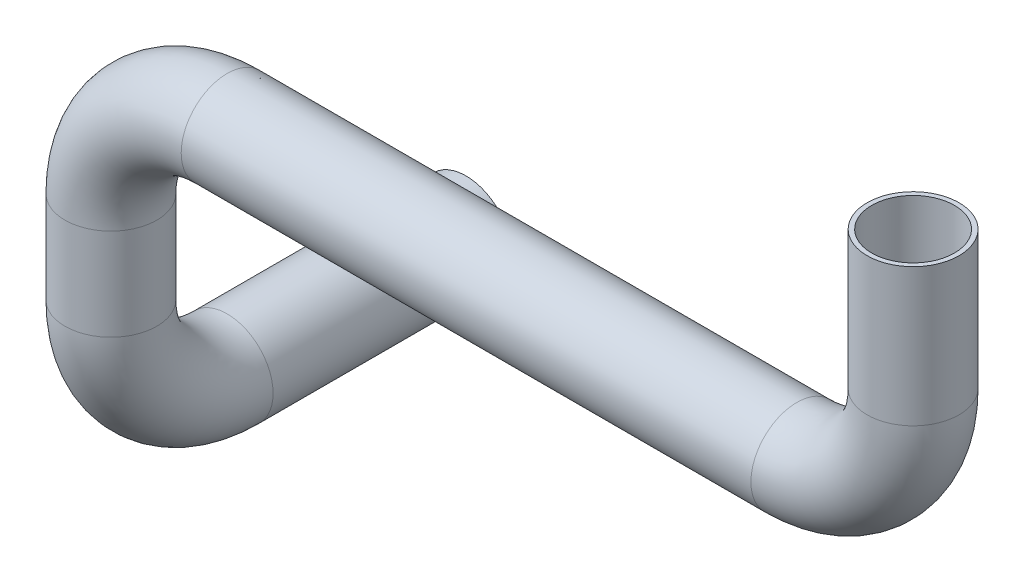
from build123d import *

# Parameters (mm, degrees)
SWEEP_THIN1_PROFILE_R   = 5
SWEEP_THIN1_PROFILE_R_2 = 4.5


with BuildPart() as part:
    # Sweep-Thin1: sweep along a curve in space
    with BuildLine() as sweep_thin1_path:
        Line((0, 0, 0), (0, -15, 0))
        ThreePointArc((0, -15, 0), (-3.705099218, -23.944900782, 0), (-12.65, -27.65, 0))
        Line((-12.65, -27.65, 0), (-74.65, -27.65, 0))
        ThreePointArc((-74.65, -27.65, 0), (-83.594900782, -31.355099218, 0), (-87.3, -40.3, 0))
        Line((-87.3, -40.3, 0), (-87.3, -50.3, 0))
        ThreePointArc((-87.3, -50.3, 0), (-87.3, -59.244900782, -3.705099218), (-87.3, -62.95, -12.65))
        Line((-87.3, -62.95, -12.65), (-87.3, -62.95, -38.65))
    # Sweep-Thin1 profile (on start of the path) → Sweep-Thin1 (sweep)
    with BuildSketch(Plane(origin=(0, 0, 0), x_dir=(0, 0, -1), z_dir=(0, -1, 0))):
        Circle(SWEEP_THIN1_PROFILE_R)
        Circle(SWEEP_THIN1_PROFILE_R_2, mode=Mode.SUBTRACT)
    sweep(path=sweep_thin1_path.line)


solid = part.part
